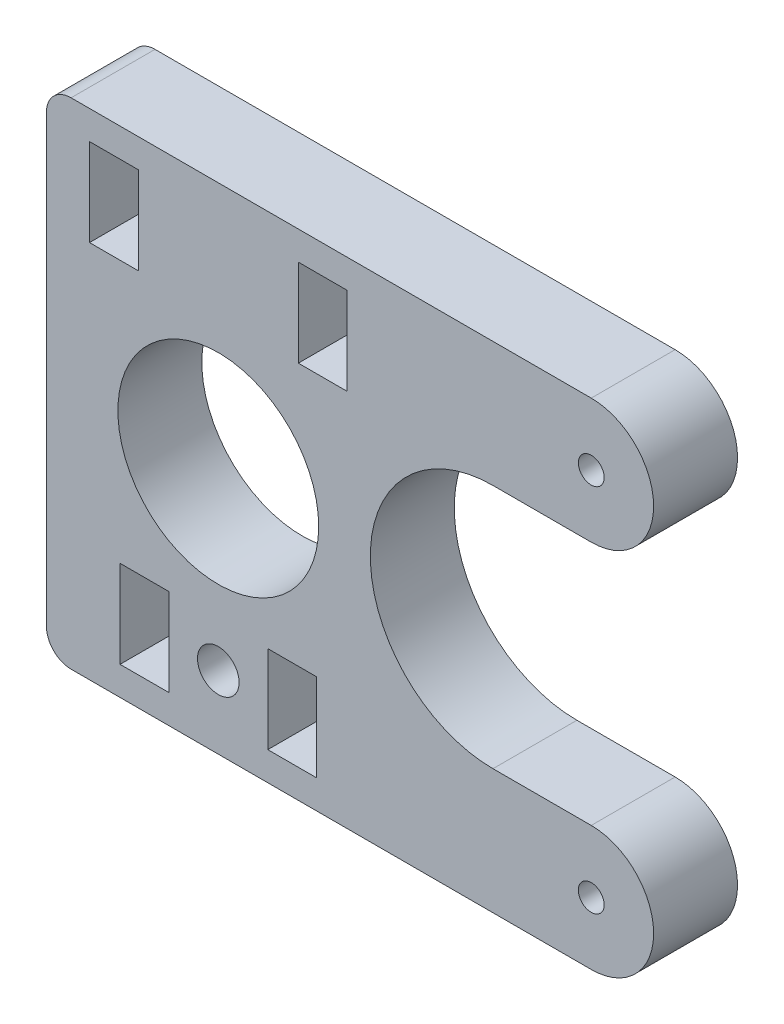
from build123d import *

# Parameters (mm, degrees)
SKETCH1_R           = 0.9
SKETCH1_R_2         = 1.45
SKETCH1_R_3         = 7
SKETCH1_W           = 3.400011
SKETCH1_H           = 6.1
SKETCH1_W_2         = 3.4
BOSS_EXTRUDE2_DEPTH = 5.85


with BuildPart() as part:
    # Sketch1 → Boss-Extrude2 (new body)
    with BuildSketch(Plane.XY):
        with BuildLine():
            Line((669.21684417, 348.01545661), (648.4638119, 348.01545661))
            ThreePointArc((648.4638119, 348.01545661), (647.249496344, 347.512470637), (646.746510371, 346.298155081))
            Line((646.746510371, 346.298155081), (646.746510371, 315.232758138))
            ThreePointArc((646.746510371, 315.232758138), (647.249496344, 314.018442582), (648.4638119, 313.51545661))
            Line((648.4638119, 313.51545661), (669.21684417, 313.51545661))
            Line((669.21684417, 313.51545661), (684.726521371, 313.51545661))
            ThreePointArc((684.726521371, 313.51545661), (689.076521371, 317.86545661), (684.726521371, 322.21545661))
            Line((684.726521371, 322.21545661), (677.876521371, 322.21545661))
            ThreePointArc((677.876521371, 322.21545661), (669.326521371, 330.76545661), (677.876521371, 339.31545661))
            Line((677.876521371, 339.31545661), (684.726521371, 339.31545661))
            ThreePointArc((684.726521371, 339.31545661), (689.076521371, 343.66545661), (684.726521371, 348.01545661))
            Line((684.726521371, 348.01545661), (669.21684417, 348.01545661))
        make_face()
        with Locations((684.726521371, 343.66545661)):
            Circle(SKETCH1_R, mode=Mode.SUBTRACT)
        with Locations((684.726521371, 317.86545661)):
            Circle(SKETCH1_R, mode=Mode.SUBTRACT)
        with Locations((658.726521371, 318.56545661)):
            Circle(SKETCH1_R_2, mode=Mode.SUBTRACT)
        with Locations((658.726521371, 330.76545661)):
            Circle(SKETCH1_R_3, mode=Mode.SUBTRACT)
        with Locations((651.446515871, 342.96545661)):
            Rectangle(SKETCH1_W, SKETCH1_H, mode=Mode.SUBTRACT)
        with Locations((653.576521371, 318.56545661)):
            Rectangle(SKETCH1_W_2, SKETCH1_H, mode=Mode.SUBTRACT)
        with Locations((666.006526871, 342.96545661)):
            Rectangle(SKETCH1_W, SKETCH1_H, mode=Mode.SUBTRACT)
        with Locations((663.876521371, 318.56545661)):
            Rectangle(SKETCH1_W_2, SKETCH1_H, mode=Mode.SUBTRACT)
    extrude(amount=BOSS_EXTRUDE2_DEPTH)


solid = part.part
